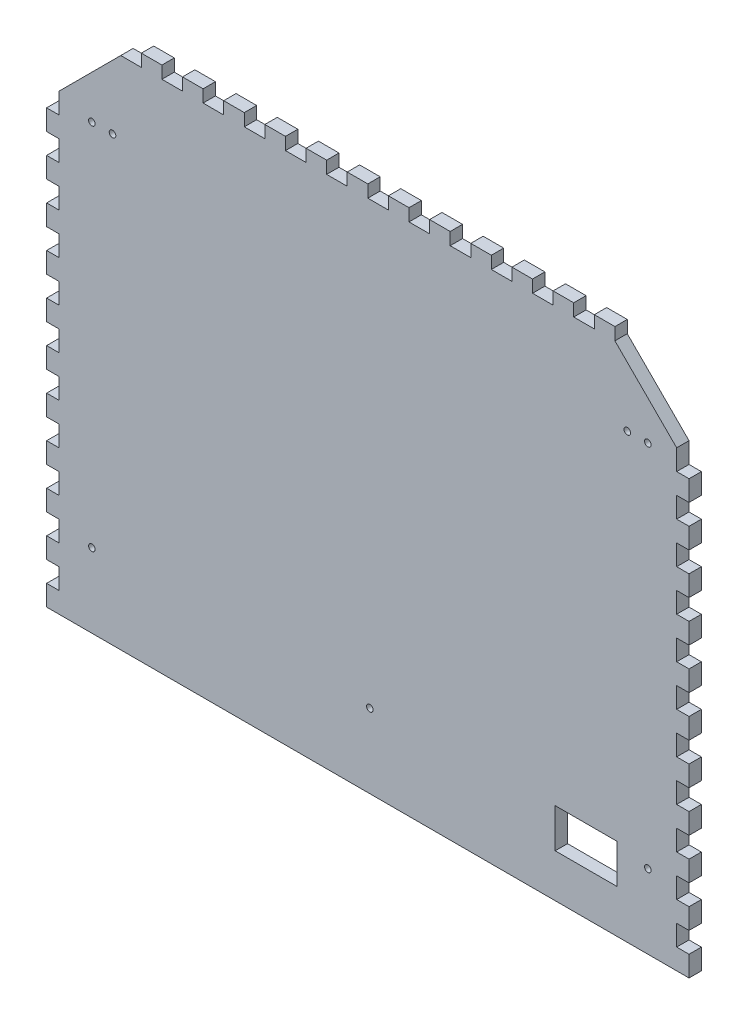
from build123d import *

# Parameters (mm, degrees)
SKIZZE1_R                       = 1.6
SKIZZE1_W                       = 30
SKIZZE1_H                       = 19
AUFSATZ_LINEAR_AUSTRAGEN1_DEPTH = 6


with BuildPart() as part:
    # Skizze1 → Aufsatz-Linear austragen1 (new body)
    with BuildSketch(Plane.XY):
        Polygon((4, 10), (4, 20), (-2, 20), (-2, 30), (4, 30), (4, 40), (-2, 40), (-2, 50), (4, 50), (4, 60), (-2, 60), (-2, 70), (4, 70), (4, 80), (-2, 80), (-2, 90), (4, 90), (4, 100), (-2, 100), (-2, 110), (4, 110), (4, 120), (-2, 120), (-2, 130), (4, 130), (4, 140), (-2, 140), (-2, 150), (4, 150), (4, 160), (-2, 160), (-2, 170), (4, 170), (4, 180), (-2, 180), (-2, 190), (4, 190), (4, 200), (-2, 200), (-2, 210), (4, 210), (4, 220), (34, 250), (44, 250), (44, 256), (54, 256), (54, 250), (64, 250), (64, 256), (74, 256), (74, 250), (84, 250), (84, 256), (94, 256), (94, 250), (104, 250), (104, 256), (114, 256), (114, 250), (124, 250), (124, 256), (134, 256), (134, 250), (144, 250), (144, 256), (154, 256), (154, 250), (164, 250), (164, 256), (174, 256), (174, 250), (184, 250), (184, 256), (194, 256), (194, 250), (204, 250), (204, 256), (214, 256), (214, 250), (224, 250), (224, 256), (234, 256), (234, 250), (244, 250), (244, 256), (254, 256), (254, 250), (264, 250), (264, 256), (274, 256), (274, 250), (304, 220), (304, 210), (310, 210), (310, 200), (304, 200), (304, 190), (310, 190), (310, 180), (304, 180), (304, 170), (310, 170), (310, 160), (304, 160), (304, 150), (310, 150), (310, 140), (304, 140), (304, 130), (310, 130), (310, 120), (304, 120), (304, 110), (310, 110), (310, 100), (304, 100), (304, 90), (310, 90), (310, 80), (304, 80), (304, 70), (310, 70), (310, 60), (304, 60), (304, 50), (310, 50), (310, 40), (304, 40), (304, 30), (310, 30), (310, 20), (304, 20), (304, 10), (310, 10), (310, 0), (304, 0), (4, 0), (-2, 0), (-2, 10), align=None)
        with Locations((20, 215)):
            Circle(SKIZZE1_R, mode=Mode.SUBTRACT)
        with Locations((30, 215)):
            Circle(SKIZZE1_R, mode=Mode.SUBTRACT)
        with Locations((290, 215)):
            Circle(SKIZZE1_R, mode=Mode.SUBTRACT)
        with Locations((280, 215)):
            Circle(SKIZZE1_R, mode=Mode.SUBTRACT)
        with Locations((20, 36)):
            Circle(SKIZZE1_R, mode=Mode.SUBTRACT)
        with Locations((155, 36)):
            Circle(SKIZZE1_R, mode=Mode.SUBTRACT)
        with Locations((290, 36)):
            Circle(SKIZZE1_R, mode=Mode.SUBTRACT)
        with Locations((260, 30.5)):
            Rectangle(SKIZZE1_W, SKIZZE1_H, mode=Mode.SUBTRACT)
    extrude(amount=AUFSATZ_LINEAR_AUSTRAGEN1_DEPTH)


solid = part.part
